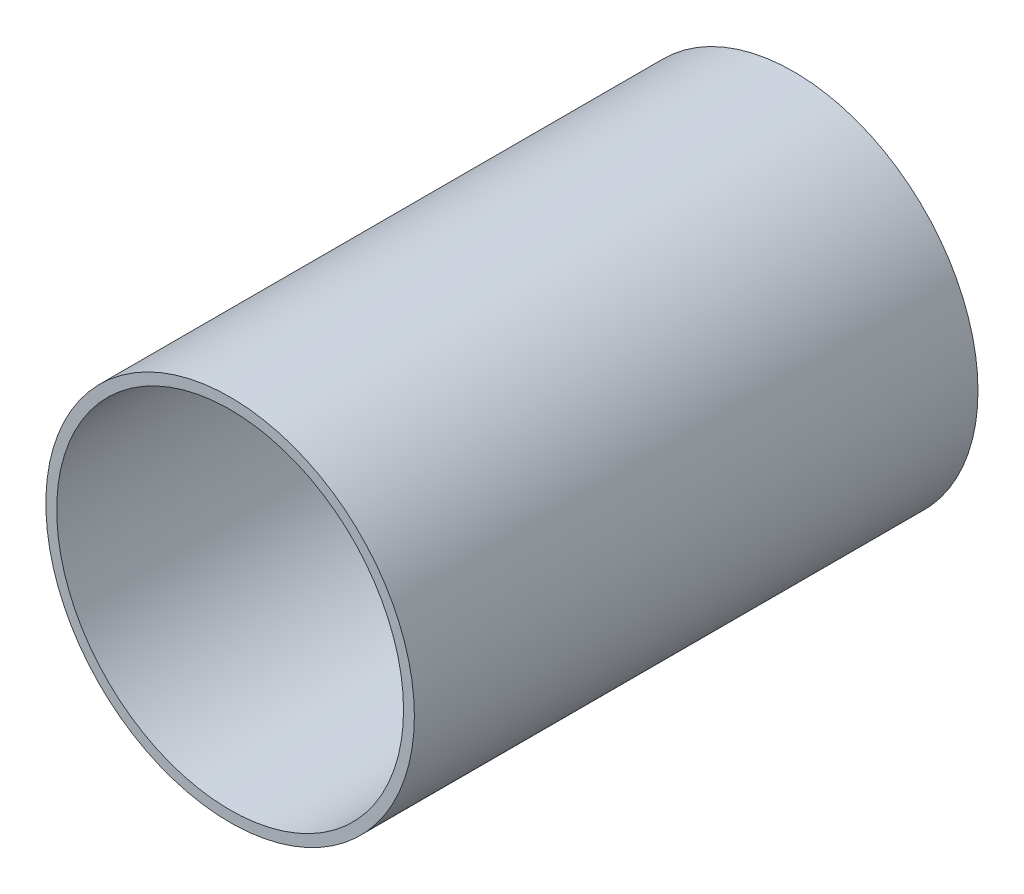
from build123d import *

# Parameters (mm, degrees)
SKETCH1_R           = 8.5
BOSS_EXTRUDE1_DEPTH = 1
SKETCH2_R           = 8.5
SKETCH2_R_2         = 8
BOSS_EXTRUDE2_DEPTH = 25
CHAMFER1_SIZE       = 1


with BuildPart() as part:
    # Sketch1 → Boss-Extrude1 (new body)
    with BuildSketch(Plane.XY):
        Circle(SKETCH1_R)
    extrude(amount=BOSS_EXTRUDE1_DEPTH)

    # Sketch2 → Boss-Extrude2 (add)
    with BuildSketch(Plane.XY.offset(1)):
        Circle(SKETCH2_R)
        Circle(SKETCH2_R_2, mode=Mode.SUBTRACT)
    extrude(amount=BOSS_EXTRUDE2_DEPTH)

    # Chamfer1
    chamfer1_edges = [part.edges().sort_by_distance(p)[0] for p in [
        (-8, 0, 1),
    ]]
    chamfer(chamfer1_edges, length=CHAMFER1_SIZE)


solid = part.part
